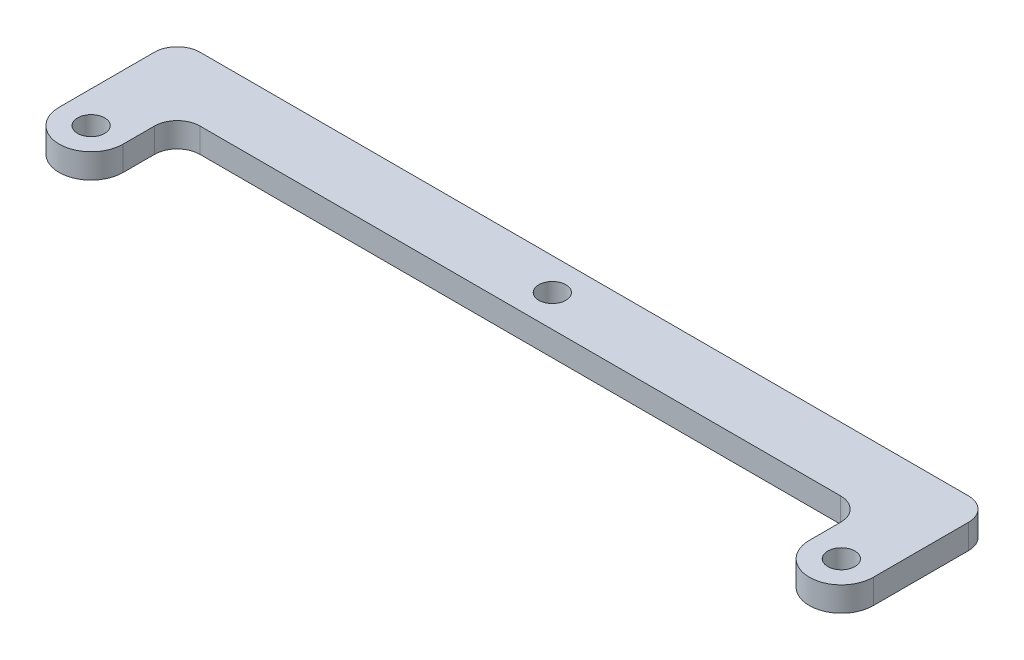
from build123d import *

# Parameters (mm, degrees)
SKETCH1_R           = 2.6
SKETCH1_R_2         = 1.1
BOSS_EXTRUDE1_DEPTH = 2


with BuildPart() as part:
    # Sketch1 → Boss-Extrude1 (new body)
    # profile 1 of 5: a face of its own
    with BuildSketch(Plane(origin=(0, 0, 0), x_dir=(1, 0, 0), z_dir=(0, 1, 0))):
        with BuildLine():
            Line((-33.1, 0.75), (-33.1, -7))
            ThreePointArc((-33.1, -7), (-30.5, -4.4), (-27.9, -7))
            Line((-27.9, -7), (-27.9, -4.45))
            ThreePointArc((-27.9, -4.45), (-27.358147545, -3.141852455), (-26.05, -2.6))
            Line((-26.05, -2.6), (-1e-09, -2.6))
            ThreePointArc((-1e-09, -2.6), (-2.6, 7e-09), (1.4e-08, 2.6))
            Line((1.4e-08, 2.6), (-31.25, 2.6))
            ThreePointArc((-31.25, 2.6), (-32.558147545, 2.058147545), (-33.1, 0.75))
        make_face()
    # profile 2 of 5: a face of its own
    with BuildSketch(Plane(origin=(0, 0, 0), x_dir=(1, 0, 0), z_dir=(0, 1, 0))):
        with BuildLine():
            Line((31.25, 2.6), (1.4e-08, 2.6))
            ThreePointArc((1.4e-08, 2.6), (1.838477636, 1.838477626), (2.6, 0))
            ThreePointArc((2.6, 0), (1.838477631, -1.838477632), (-1e-09, -2.6))
            Line((-1e-09, -2.6), (26.05, -2.6))
            ThreePointArc((26.05, -2.6), (27.358147545, -3.141852455), (27.9, -4.45))
            Line((27.9, -4.45), (27.9, -7))
            ThreePointArc((27.9, -7), (30.5, -4.4), (33.1, -7))
            Line((33.1, -7), (33.1, 0.75))
            ThreePointArc((33.1, 0.75), (32.558147545, 2.058147545), (31.25, 2.6))
        make_face()
    # profile 3 of 5: a face of its own
    with BuildSketch(Plane(origin=(0, 0, 0), x_dir=(1, 0, 0), z_dir=(0, 1, 0))):
        Circle(SKETCH1_R)
        with Locations(Location((0, 0, 0), (0, 0, 270))):
            Circle(SKETCH1_R_2, mode=Mode.SUBTRACT)
    # profile 4 of 5: a face of its own
    with BuildSketch(Plane(origin=(0, 0, 0), x_dir=(1, 0, 0), z_dir=(0, 1, 0))):
        with Locations((30.5, -7)):
            Circle(SKETCH1_R)
        with Locations(Location((30.5, -7, 0), (0, 0, 270))):
            Circle(SKETCH1_R_2, mode=Mode.SUBTRACT)
    # profile 5 of 5: a face of its own
    with BuildSketch(Plane(origin=(0, 0, 0), x_dir=(1, 0, 0), z_dir=(0, 1, 0))):
        with Locations((-30.5, -7)):
            Circle(SKETCH1_R)
        with Locations(Location((-30.5, -7, 0), (0, 0, 270))):
            Circle(SKETCH1_R_2, mode=Mode.SUBTRACT)
    extrude(amount=BOSS_EXTRUDE1_DEPTH)


solid = part.part
